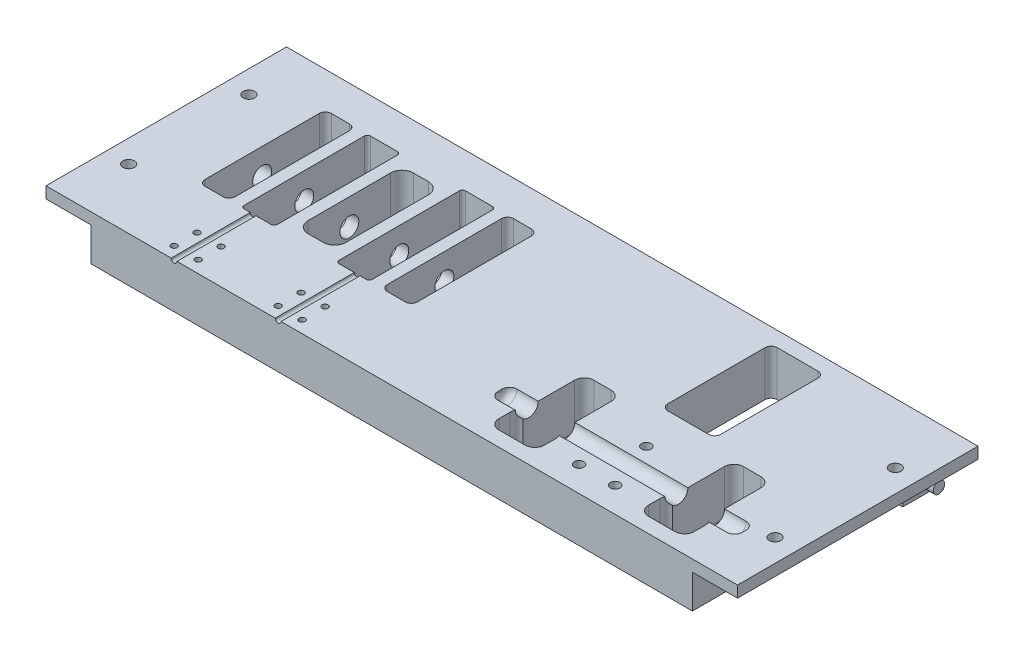
from build123d import *

# Parameters (mm, degrees)
SKETCH1_W           = 292.1
SKETCH1_H           = 101.6
BOSS_EXTRUDE1_DEPTH = 25.4
SKETCH3_W           = 19.05
SKETCH3_H           = 20.574
CUT_EXTRUDE1_DEPTH  = 101.6
SKETCH4_W           = 88.9
SKETCH4_H           = 6.35
CUT_EXTRUDE2_DEPTH  = 273.05
CUT_EXTRUDE4_REACH  = 190.038
SKETCH10_W          = 13.97
SKETCH10_H          = 53.34
CUT_EXTRUDE5_DEPTH  = 19.05
FILLET3_R           = 1.27
FILLET4_R           = 1.27
SKETCH11_W          = 12.7
SKETCH11_H          = 53.34
CUT_EXTRUDE6_DEPTH  = 19.05
FILLET5_R           = 2.54
SKETCH12_W          = 13.97
SKETCH12_H          = 53.34
CUT_EXTRUDE7_DEPTH  = 19.05
SKETCH14_W          = 12.7
SKETCH14_H          = 53.34
CUT_EXTRUDE9_DEPTH  = 19.05
FILLET8_R           = 2.54
FILLET9_R           = 1.27
CUT_EXTRUDE10_REACH = 207.024
SKETCH5_W           = 19.05
SKETCH5_H           = 20.574
SKETCH21_R          = 3.999992
CUT_EXTRUDE11_DEPTH = 12.192
CUT_EXTRUDE14_START = -101.854
SKETCH25_R          = 3.999992
CUT_EXTRUDE14_DEPTH = 101.854
SKETCH27_R          = 1.2065
CUT_EXTRUDE15_DEPTH = 33.401
SKETCH28_R          = 1.2065
CUT_EXTRUDE16_DEPTH = 33.401
SKETCH30_W          = 103.124
SKETCH30_H          = 4.064
FILLET17_R          = 3.175
FILLET18_R          = 3.175
SKETCH32_R          = 2.032
CUT_EXTRUDE19_DEPTH = 19.05
SKETCH33_W          = 12.7
SKETCH33_H          = 6.35
CUT_EXTRUDE20_DEPTH = 254
SKETCH34_R          = 4.0000047
CUT_EXTRUDE22_DEPTH = 61.976
SKETCH38_R          = 2.413
CUT_EXTRUDE23_DEPTH = 4.826
SKETCH40_R          = 1.27
CUT_EXTRUDE24_DEPTH = 2.54
SKETCH42_W          = 8.89
SKETCH42_H          = 12.7
BOSS_EXTRUDE2_DEPTH = 6.35
SKETCH43_R          = 2.413
BOSS_EXTRUDE3_DEPTH = 7.62


with BuildPart() as part:
    # Sketch1 → Boss-Extrude1 (new body)
    with BuildSketch(Plane(origin=(0, 0, 0), x_dir=(1, 0, 0), z_dir=(0, 1, 0))):
        with Locations((30.208995816, -9.580035864)):
            Rectangle(SKETCH1_W, SKETCH1_H)
    extrude(amount=BOSS_EXTRUDE1_DEPTH)

    # Sketch3 → Cut-Extrude1 (cut)
    with BuildSketch(Plane(origin=(0, 0, -41.219964136), x_dir=(-1, 0, 0), z_dir=(0, 0, -1))):
        with Locations((-166.733995816, 10.287)):
            Rectangle(SKETCH3_W, SKETCH3_H)
    extrude(amount=-CUT_EXTRUDE1_DEPTH, mode=Mode.SUBTRACT)

    # Sketch4 → Cut-Extrude2 (cut)
    with BuildSketch(Plane(origin=(157.208995816, 0, 0), x_dir=(0, 0, -1), z_dir=(1, 0, 0))):
        with Locations((-15.930035864, 3.175)):
            Rectangle(SKETCH4_W, SKETCH4_H)
    extrude(amount=-CUT_EXTRUDE2_DEPTH, mode=Mode.SUBTRACT)

    # Cut-Extrude4: up to this face of the body (flat: up to its plane)
    cut_extrude4_end = Plane(part.part.faces().sort_by_distance((20.683995816, 0, -34.869964136))[0])
    # Sketch8 → Cut-Extrude4 (cut, up to the picked face)
    with BuildSketch(Plane(origin=(0, 25.4, 0), x_dir=(1, 0, 0), z_dir=(0, 1, 0)), mode=Mode.PRIVATE) as cut_extrude4_sk1:
        with BuildLine():
            Line((115.044995816, -11.358035864), (97.772995816, -11.358035864))
            ThreePointArc((97.772995816, -11.358035864), (95.976944592, -10.614087088), (95.232995816, -8.818035864))
            Line((95.232995816, -8.818035864), (95.232995816, 32.329964136))
            ThreePointArc((95.232995816, 32.329964136), (95.976944592, 34.12601536), (97.772995816, 34.869964136))
            Line((97.772995816, 34.869964136), (115.044995816, 34.869964136))
            ThreePointArc((115.044995816, 34.869964136), (116.84104704, 34.12601536), (117.584995816, 32.329964136))
            Line((117.584995816, 32.329964136), (117.584995816, -8.818035864))
            ThreePointArc((117.584995816, -8.818035864), (116.84104704, -10.614087088), (115.044995816, -11.358035864))
        make_face()
    cut_extrude4_tool1 = split(extrude(cut_extrude4_sk1.sketch, amount=-CUT_EXTRUDE4_REACH, mode=Mode.PRIVATE), bisect_by=cut_extrude4_end, keep=Keep.BOTH, mode=Mode.PRIVATE)
    # Sketch8 → Cut-Extrude4 (cut, up to the picked face)
    with BuildSketch(Plane(origin=(0, 25.4, 0), x_dir=(1, 0, 0), z_dir=(0, 1, 0)), mode=Mode.PRIVATE) as cut_extrude4_sk2:
        with BuildLine():
            Line((-36.593004184, -22.534035864), (-42.943004184, -22.534035864))
            ThreePointArc((-42.943004184, -22.534035864), (-46.35550151, -21.12053319), (-47.769004184, -17.708035864))
            Line((-47.769004184, -17.708035864), (-47.769004184, 17.089964136))
            ThreePointArc((-47.769004184, 17.089964136), (-46.35550151, 20.502461462), (-42.943004184, 21.915964136))
            Line((-42.943004184, 21.915964136), (-36.593004184, 21.915964136))
            ThreePointArc((-36.593004184, 21.915964136), (-33.180506858, 20.502461462), (-31.767004184, 17.089964136))
            Line((-31.767004184, 17.089964136), (-31.767004184, -17.708035864))
            ThreePointArc((-31.767004184, -17.708035864), (-33.180506858, -21.12053319), (-36.593004184, -22.534035864))
        make_face()
    cut_extrude4_tool2 = split(extrude(cut_extrude4_sk2.sketch, amount=-CUT_EXTRUDE4_REACH, mode=Mode.PRIVATE), bisect_by=cut_extrude4_end, keep=Keep.BOTH, mode=Mode.PRIVATE)
    # Sketch8 → Cut-Extrude4 (cut, up to the picked face)
    with BuildSketch(Plane(origin=(0, 25.4, 0), x_dir=(1, 0, 0), z_dir=(0, 1, 0)), mode=Mode.PRIVATE) as cut_extrude4_sk3:
        with BuildLine():
            Line((141.587995816, -15.788953669), (134.221995816, -15.788953669))
            ThreePointArc((134.221995816, -15.788953669), (131.348313857, -16.97927171), (130.157995816, -19.852953669))
            Line((130.157995816, -19.852953669), (130.157995816, -41.696953669))
            ThreePointArc((130.157995816, -41.696953669), (128.760995816, -43.172560324), (128.252995816, -45.140035864))
            Line((128.252995816, -45.140035864), (128.252995816, -49.966035864))
            ThreePointArc((128.252995816, -49.966035864), (129.443313857, -52.839717822), (132.316995816, -54.030035864))
            Line((132.316995816, -54.030035864), (143.492995816, -54.030035864))
            ThreePointArc((143.492995816, -54.030035864), (146.366677775, -52.839717822), (147.556995816, -49.966035864))
            Line((147.556995816, -49.966035864), (147.556995816, -45.140035864))
            ThreePointArc((147.556995816, -45.140035864), (147.048995816, -43.172560324), (145.651995816, -41.696953669))
            Line((145.651995816, -41.696953669), (145.651995816, -19.852953669))
            ThreePointArc((145.651995816, -19.852953669), (144.461677775, -16.97927171), (141.587995816, -15.788953669))
        make_face()
    cut_extrude4_tool3 = split(extrude(cut_extrude4_sk3.sketch, amount=-CUT_EXTRUDE4_REACH, mode=Mode.PRIVATE), bisect_by=cut_extrude4_end, keep=Keep.BOTH, mode=Mode.PRIVATE)
    # Sketch8 → Cut-Extrude4 (cut, up to the picked face)
    with BuildSketch(Plane(origin=(0, 25.4, 0), x_dir=(1, 0, 0), z_dir=(0, 1, 0)), mode=Mode.PRIVATE) as cut_extrude4_sk4:
        with BuildLine():
            Line((78.341995816, -15.788953669), (70.975995816, -15.788953669))
            ThreePointArc((70.975995816, -15.788953669), (68.102313857, -16.97927171), (66.911995816, -19.852953669))
            Line((66.911995816, -19.852953669), (66.911995816, -41.696953669))
            ThreePointArc((66.911995816, -41.696953669), (65.514995816, -43.172560324), (65.006995816, -45.140035864))
            Line((65.006995816, -45.140035864), (65.006995816, -49.966035864))
            ThreePointArc((65.006995816, -49.966035864), (66.197313857, -52.839717822), (69.070995816, -54.030035864))
            Line((69.070995816, -54.030035864), (80.246995816, -54.030035864))
            ThreePointArc((80.246995816, -54.030035864), (83.120677775, -52.839717822), (84.310995816, -49.966035864))
            Line((84.310995816, -49.966035864), (84.310995816, -45.140035864))
            ThreePointArc((84.310995816, -45.140035864), (83.802995816, -43.172560324), (82.405995816, -41.696953669))
            Line((82.405995816, -41.696953669), (82.405995816, -19.852953669))
            ThreePointArc((82.405995816, -19.852953669), (81.215677775, -16.97927171), (78.341995816, -15.788953669))
        make_face()
    cut_extrude4_tool4 = split(extrude(cut_extrude4_sk4.sketch, amount=-CUT_EXTRUDE4_REACH, mode=Mode.PRIVATE), bisect_by=cut_extrude4_end, keep=Keep.BOTH, mode=Mode.PRIVATE)
    add(cut_extrude4_tool1.solids().sort_by(Axis((106.408996, 25.4, -11.755964), (0, -1, 0)))[0], mode=Mode.SUBTRACT)
    add(cut_extrude4_tool2.solids().sort_by(Axis((-39.768004, 25.4, 0.309036), (0, -1, 0)))[0], mode=Mode.SUBTRACT)
    add(cut_extrude4_tool3.solids().sort_by(Axis((137.904996, 25.4, 35.841751), (0, -1, 0)))[0], mode=Mode.SUBTRACT)
    add(cut_extrude4_tool4.solids().sort_by(Axis((74.658996, 25.4, 35.841751), (0, -1, 0)))[0], mode=Mode.SUBTRACT)

    # Sketch10 → Cut-Extrude5 (cut)
    with BuildSketch(Plane(origin=(0, 25.4, 0), x_dir=(1, 0, 0), z_dir=(0, 1, 0))):
        with Locations((-19.702004184, -0.309035864)):
            Rectangle(SKETCH10_W, SKETCH10_H)
    extrude(amount=-CUT_EXTRUDE5_DEPTH, mode=Mode.SUBTRACT)

    # Fillet3
    fillet3_edges = [part.edges().sort_by_distance(p)[0] for p in [
        (-26.687004184, 15.875, -26.360964136),
    ]]
    fillet(fillet3_edges, radius=FILLET3_R)

    # Fillet4
    fillet4_edges = [part.edges().sort_by_distance(p)[0] for p in [
        (-26.687004184, 15.875, 26.979035864),
        (-12.717004184, 15.875, -26.360964136),
        (-12.717004184, 15.875, 26.979035864),
    ]]
    fillet(fillet4_edges, radius=FILLET4_R)

    # Sketch11 → Cut-Extrude6 (cut)
    with BuildSketch(Plane(origin=(0, 25.4, 0), x_dir=(1, 0, 0), z_dir=(0, 1, 0))):
        with Locations((-1.287004184, -0.309035864)):
            Rectangle(SKETCH11_W, SKETCH11_H)
    extrude(amount=-CUT_EXTRUDE6_DEPTH, mode=Mode.SUBTRACT)

    # Fillet5
    fillet5_edges = [part.edges().sort_by_distance(p)[0] for p in [
        (-7.637004184, 15.875, 26.979035864),
        (-7.637004184, 15.875, -26.360964136),
        (5.062995816, 15.875, -26.360964136),
        (5.062995816, 15.875, 26.979035864),
    ]]
    fillet(fillet5_edges, radius=FILLET5_R)

    # Sketch12 → Cut-Extrude7 (cut)
    with BuildSketch(Plane(origin=(0, 25.4, 0), x_dir=(1, 0, 0), z_dir=(0, 1, 0))):
        with Locations((-59.834004184, -0.309035864)):
            Rectangle(SKETCH12_W, SKETCH12_H)
    extrude(amount=-CUT_EXTRUDE7_DEPTH, mode=Mode.SUBTRACT)

    # Sketch14 → Cut-Extrude9 (cut)
    with BuildSketch(Plane(origin=(0, 25.4, 0), x_dir=(1, 0, 0), z_dir=(0, 1, 0))):
        with Locations((-78.249004184, -0.309035864)):
            Rectangle(SKETCH14_W, SKETCH14_H)
    extrude(amount=-CUT_EXTRUDE9_DEPTH, mode=Mode.SUBTRACT)

    # Fillet8
    fillet8_edges = [part.edges().sort_by_distance(p)[0] for p in [
        (-84.599004184, 15.875, 26.979035864),
        (-84.599004184, 15.875, -26.360964136),
        (-71.899004184, 15.875, -26.360964136),
        (-71.899004184, 15.875, 26.979035864),
    ]]
    fillet(fillet8_edges, radius=FILLET8_R)

    # Fillet9
    fillet9_edges = [part.edges().sort_by_distance(p)[0] for p in [
        (-66.819004184, 15.875, 26.979035864),
        (-66.819004184, 15.875, -26.360964136),
        (-52.849004184, 15.875, -26.360964136),
        (-52.849004184, 15.875, 26.979035864),
    ]]
    fillet(fillet9_edges, radius=FILLET9_R)

    # Cut-Extrude10: up to this face of the body (flat: up to its plane)
    cut_extrude10_end = Plane(part.part.faces().sort_by_distance((23.220513183, 15.998517367, 60.380035864))[0])
    # Sketch5 → Cut-Extrude10 (cut, up to the picked face)
    with BuildSketch(Plane(origin=(0, 0, -41.219964136), x_dir=(-1, 0, 0), z_dir=(0, 0, -1)), mode=Mode.PRIVATE) as cut_extrude10_sk1:
        with Locations((106.316004184, 10.287)):
            Rectangle(SKETCH5_W, SKETCH5_H)
    cut_extrude10_tool1 = split(extrude(cut_extrude10_sk1.sketch, amount=-CUT_EXTRUDE10_REACH, mode=Mode.PRIVATE), bisect_by=cut_extrude10_end, keep=Keep.BOTH, mode=Mode.PRIVATE)
    add(cut_extrude10_tool1.solids().sort_by(Axis((-106.316004, 10.287, -41.219964), (0, 0, 1)))[0], mode=Mode.SUBTRACT)

    # Sketch21 → Cut-Extrude11 (cut)
    with BuildSketch(Plane(origin=(-84.599004184, 0, 0), x_dir=(0, 0, -1), z_dir=(1, 0, 0))):
        with Locations((-0.309035864, 14.364208)):
            Circle(SKETCH21_R)
    extrude(amount=-CUT_EXTRUDE11_DEPTH, mode=Mode.SUBTRACT)

    # Sketch25 → Cut-Extrude14 (cut)
    with BuildSketch(Plane.ZY.offset(96.791004184).offset(CUT_EXTRUDE14_START)):
        with Locations(Location((0.309035864, 14.364208, 0), (0, 0, 180))):
            Circle(SKETCH25_R)
    extrude(amount=CUT_EXTRUDE14_DEPTH, mode=Mode.SUBTRACT)

    # Sketch27 → Cut-Extrude15 (cut)
    with BuildSketch(Plane(origin=(0, 0, 26.979035864), x_dir=(-1, 0, 0), z_dir=(0, 0, -1))):
        with Locations((61.739004184, 25.4)):
            Circle(SKETCH27_R)
    extrude(amount=-CUT_EXTRUDE15_DEPTH, mode=Mode.SUBTRACT)

    # Sketch28 → Cut-Extrude16 (cut)
    with BuildSketch(Plane(origin=(0, 0, 26.979035864), x_dir=(-1, 0, 0), z_dir=(0, 0, -1))):
        with Locations((17.797004184, 25.4)):
            Circle(SKETCH28_R)
    extrude(amount=-CUT_EXTRUDE16_DEPTH, mode=Mode.SUBTRACT)

    # Sketch30 → Cut-Revolve1 (revolve, cut)
    with BuildSketch(Plane(origin=(0, 25.4, 0), x_dir=(1, 0, 0), z_dir=(0, 1, 0))):
        with Locations((106.408995816, -37.266035864)):
            Rectangle(SKETCH30_W, SKETCH30_H)
    revolve(axis=Axis((157.970995816, 25.4, 39.298035864), (-1, 0, 0)), mode=Mode.SUBTRACT)

    # Fillet17
    fillet17_edges = [part.edges().sort_by_distance(p)[0] for p in [
        (157.970995816, 21.336, 39.298035864),
    ]]
    fillet(fillet17_edges, radius=FILLET17_R)

    # Fillet18
    fillet18_edges = [part.edges().sort_by_distance(p)[0] for p in [
        (54.846995816, 21.336, 39.298035864),
    ]]
    fillet(fillet18_edges, radius=FILLET18_R)

    # Sketch32 → Cut-Extrude19 (cut)
    with BuildSketch(Plane(origin=(0, 25.4, 0), x_dir=(1, 0, 0), z_dir=(0, 1, 0))):
        with Locations(Location((106.281995816, -28.884035864, 0), (0, 0, 270))):
            Circle(SKETCH32_R)
        with Locations(Location((98.661995816, -49.712035864, 0), (0, 0, 270))):
            Circle(SKETCH32_R)
        with Locations(Location((113.901995816, -49.712035864, 0), (0, 0, 270))):
            Circle(SKETCH32_R)
    extrude(amount=-CUT_EXTRUDE19_DEPTH, mode=Mode.SUBTRACT)

    # Sketch33 → Cut-Extrude20 (cut)
    with BuildSketch(Plane.ZY.offset(96.791004184)):
        with Locations((-34.869964136, 3.175)):
            Rectangle(SKETCH33_W, SKETCH33_H)
    extrude(amount=-CUT_EXTRUDE20_DEPTH, mode=Mode.SUBTRACT)

    # Sketch34 → Cut-Extrude22 (cut)
    with BuildSketch(Plane(origin=(95.232995816, 0, 0), x_dir=(0, 0, -1), z_dir=(1, 0, 0))):
        with Locations(Location((11.755964136, 15.875, 0), (0, 0, 180))):
            Circle(SKETCH34_R)
    extrude(amount=CUT_EXTRUDE22_DEPTH, mode=Mode.SUBTRACT)

    # Sketch38 → Cut-Extrude23 (cut)
    with BuildSketch(Plane.XZ.offset(-20.574)):
        with Locations(Location((166.733995816, 34.980035864, 0), (0, 0, 270))):
            Circle(SKETCH38_R)
        with Locations(Location((166.733995816, -15.819964136, 0), (0, 0, 270))):
            Circle(SKETCH38_R)
    cut_extrude23 = extrude(amount=-CUT_EXTRUDE23_DEPTH, mode=Mode.SUBTRACT)

    # Mirror1: Cut-Extrude23 across plane
    add(cut_extrude23.mirror(Plane(origin=(30.208995816, 0, 0), x_dir=(0, 0, 1), z_dir=(1, 0, 0))), mode=Mode.SUBTRACT)

    # Sketch40 → Cut-Extrude24 (cut)
    with BuildSketch(Plane(origin=(0, 25.4, 0), x_dir=(1, 0, 0), z_dir=(0, 1, 0))):
        with Locations(Location((-66.819004184, -55.300035864, 0), (0, 0, 270))):
            Circle(SKETCH40_R)
        with Locations(Location((-66.819004184, -45.612704464, 0), (0, 0, 270))):
            Circle(SKETCH40_R)
        with Locations(Location((-56.659004184, -55.300035864, 0), (0, 0, 270))):
            Circle(SKETCH40_R)
        with Locations(Location((-56.659004184, -45.612704464, 0), (0, 0, 270))):
            Circle(SKETCH40_R)
    cut_extrude24 = extrude(amount=-CUT_EXTRUDE24_DEPTH, mode=Mode.SUBTRACT)

    # Mirror2: Cut-Extrude24 across plane
    add(cut_extrude24.mirror(Plane.ZY.offset(39.768004184)), mode=Mode.SUBTRACT)

    # Sketch42 → Boss-Extrude2 (add)
    with BuildSketch(Plane.XZ.offset(-6.35)):
        with Locations((-92.346004184, -34.869964136)):
            Rectangle(SKETCH42_W, SKETCH42_H)
    boss_extrude2 = extrude(amount=BOSS_EXTRUDE2_DEPTH)

    # Sketch43 → Boss-Extrude3 (add)
    with BuildSketch(Plane.ZY.offset(96.791004184)):
        with Locations(Location((-36.139964136, 7.112, 0), (0, 0, 180))):
            Circle(SKETCH43_R)
    boss_extrude3 = extrude(amount=BOSS_EXTRUDE3_DEPTH)

    # Mirror3: Boss-Extrude2, Boss-Extrude3 across plane
    add(boss_extrude2.mirror(Plane(origin=(30.208995816, 0, 0), x_dir=(0, 0, 1), z_dir=(1, 0, 0))))
    add(boss_extrude3.mirror(Plane(origin=(30.208995816, 0, 0), x_dir=(0, 0, 1), z_dir=(1, 0, 0))))


solid = part.part
